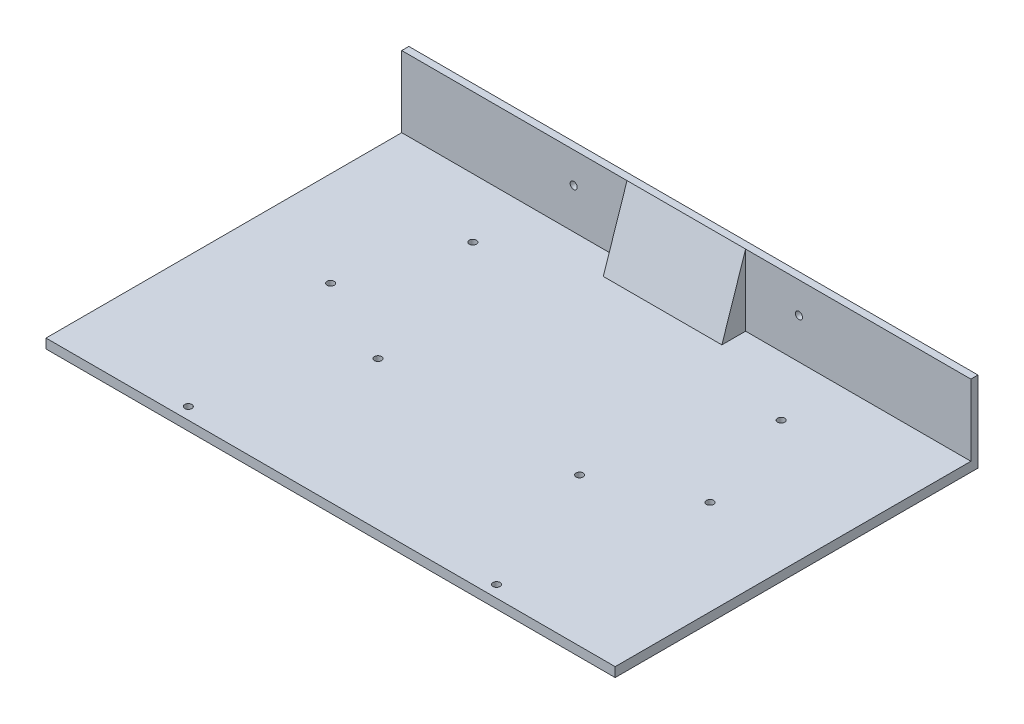
from build123d import *

# Parameters (mm, degrees)
SKETCH1_W           = 240
SKETCH1_H           = 150
BOSS_EXTRUDE1_DEPTH = 4
SKETCH3_R           = 1.5
CUT_EXTRUDE1_DEPTH  = 50
SKETCH5_W           = 240
SKETCH5_H           = 34
SKETCH5_R           = 1.5
BOSS_EXTRUDE4_DEPTH = 3
BOSS_EXTRUDE5_DEPTH = 25
SKETCH4_R           = 1.5
CUT_EXTRUDE2_DEPTH  = 147.232691283
SKETCH2_R           = 1.5
CUT_EXTRUDE3_DEPTH  = 10


with BuildPart() as part:
    # Sketch1 → Boss-Extrude1 (new body)
    with BuildSketch(Plane(origin=(0, 0, 0), x_dir=(1, 0, 0), z_dir=(0, 1, 0))):
        Rectangle(SKETCH1_W, SKETCH1_H)
    extrude(amount=BOSS_EXTRUDE1_DEPTH)

    # Sketch3 → Cut-Extrude1 (cut)
    with BuildSketch(Plane(origin=(0, 4, 0), x_dir=(1, 0, 0), z_dir=(0, 1, 0))):
        with Locations(Location((-65, 50, 0), (0, 0, 270))):
            Circle(SKETCH3_R)
        with Locations(Location((65, 50, 0), (0, 0, 270))):
            Circle(SKETCH3_R)
        with Locations(Location((65, -70, 0), (0, 0, 270))):
            Circle(SKETCH3_R)
        with Locations(Location((-65, -70, 0), (0, 0, 270))):
            Circle(SKETCH3_R)
    extrude(amount=-CUT_EXTRUDE1_DEPTH, mode=Mode.SUBTRACT)

    # Sketch5 → Boss-Extrude4 (add)
    with BuildSketch(Plane(origin=(0, 0, -75), x_dir=(-1, 0, 0), z_dir=(0, 0, -1))):
        with Locations((0, 17)):
            Rectangle(SKETCH5_W, SKETCH5_H)
        with Locations((47.5, 21)):
            Circle(SKETCH5_R, mode=Mode.SUBTRACT)
        with Locations((-47.5, 21)):
            Circle(SKETCH5_R, mode=Mode.SUBTRACT)
    extrude(amount=BOSS_EXTRUDE4_DEPTH)

    # Sketch8 → Boss-Extrude5 (add, symmetric)
    with BuildSketch(Plane(origin=(0, 0, 0), x_dir=(0, 0, -1), z_dir=(1, 0, 0))):
        Polygon((75, 34), (65, 4), (75, 4), align=None)
    extrude(amount=BOSS_EXTRUDE5_DEPTH, both=True)

    # Sketch4 → Cut-Extrude2 (cut, through all)
    with BuildSketch(Plane(origin=(0, 4, 0), x_dir=(1, 0, 0), z_dir=(0, 1, 0))):
        with Locations(Location((42.5, -12.5, 0), (0, 0, 270))):
            Circle(SKETCH4_R)
        with Locations(Location((-42.5, -12.5, 0), (0, 0, 270))):
            Circle(SKETCH4_R)
    extrude(amount=-CUT_EXTRUDE2_DEPTH, mode=Mode.SUBTRACT)

    # Sketch2 → Cut-Extrude3 (cut)
    with BuildSketch(Plane.XZ):
        with Locations(Location((80, -5, 0), (0, 0, 270))):
            Circle(SKETCH2_R)
        with Locations(Location((-80, -5, 0), (0, 0, 270))):
            Circle(SKETCH2_R)
    extrude(amount=-CUT_EXTRUDE3_DEPTH, mode=Mode.SUBTRACT)


solid = part.part
